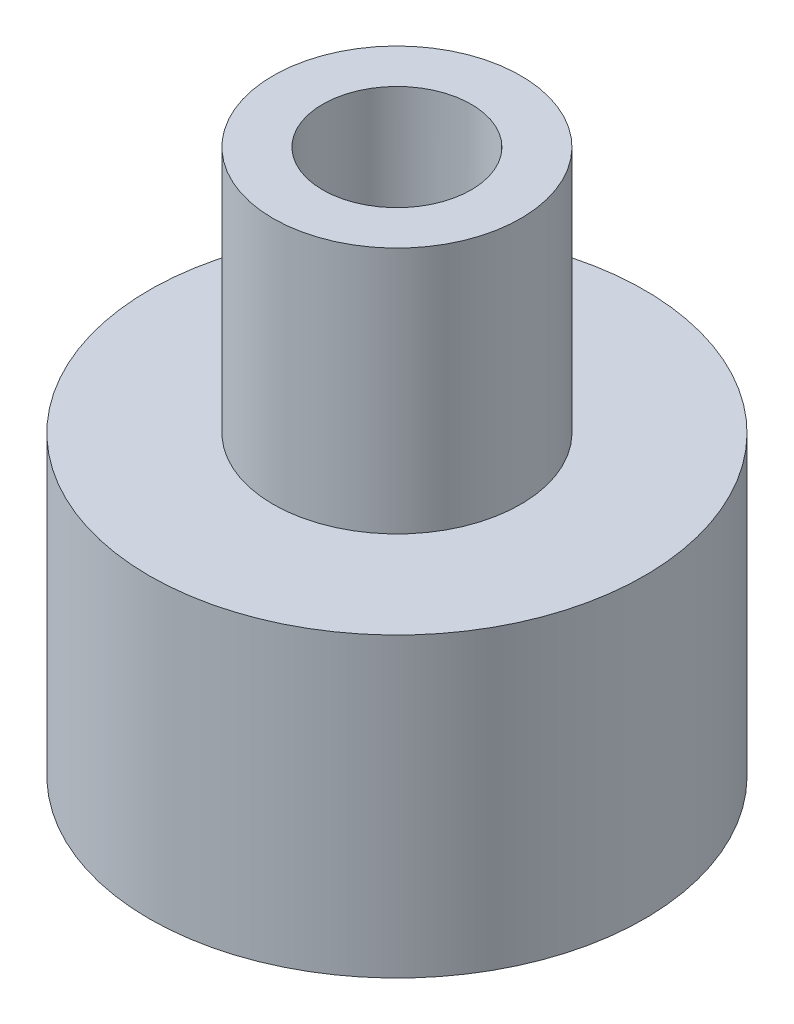
from build123d import *

# Parameters (mm, degrees)
ESQUISSE1_R             = 5
BOSS_EXTRU_1_DEPTH      = 6
BOSS_EXTRU_2_DEPTH      = 5
BOSS_EXTRU_2_DEPTH_BACK = 1
ESQUISSE2_R             = 2.5
ESQUISSE3_R             = 1.5
ENL_V_MAT_EXTRU_2_DEPTH = 6
ESQUISSE4_R             = 2.55
ENL_V_MAT_EXTRU_3_DEPTH = 5


with BuildPart() as part:
    # Esquisse1 → Boss.-Extru.1 (new body)
    with BuildSketch(Plane(origin=(0, 0, 0), x_dir=(1, 0, 0), z_dir=(0, 1, 0))):
        with Locations(Location((0, 0, 0), (0, 0, 270))):
            Circle(ESQUISSE1_R)
    extrude(amount=BOSS_EXTRU_1_DEPTH)

    # Esquisse2 → Boss.-Extru.2 (add, two sides: drawn at the far end of the back side and taken through both)
    with BuildSketch(Plane(origin=(0, 6, 0), x_dir=(1, 0, 0), z_dir=(0, 1, 0)).offset(-BOSS_EXTRU_2_DEPTH_BACK)):
        with Locations(Location((0, 0, 0), (0, 0, 270))):
            Circle(ESQUISSE2_R)
    extrude(amount=BOSS_EXTRU_2_DEPTH + BOSS_EXTRU_2_DEPTH_BACK)

    # Esquisse3 → Enlèv. mat.-Extru.2 (cut)
    with BuildSketch(Plane(origin=(0, 11, 0), x_dir=(1, 0, 0), z_dir=(0, 1, 0))):
        with Locations(Location((0, 0, 0), (0, 0, 270))):
            Circle(ESQUISSE3_R)
    extrude(amount=-ENL_V_MAT_EXTRU_2_DEPTH, mode=Mode.SUBTRACT)

    # Esquisse4 → Enlèv. mat.-Extru.3 (cut)
    with BuildSketch(Plane.XZ):
        with Locations(Location((0, 0, 0), (0, 0, 270))):
            Circle(ESQUISSE4_R)
    extrude(amount=-ENL_V_MAT_EXTRU_3_DEPTH, mode=Mode.SUBTRACT)


solid = part.part
